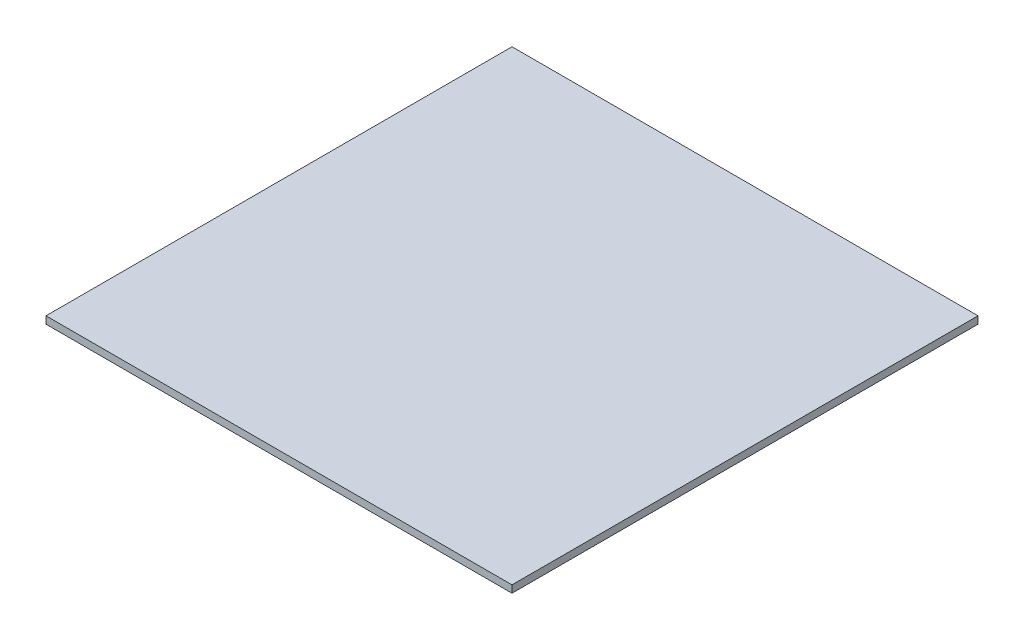
from build123d import *

# Parameters (mm, degrees)
SKETCH1_W           = 304.8
SKETCH1_H           = 304.8
BOSS_EXTRUDE1_DEPTH = 2.38125


with BuildPart() as part:
    # Sketch1 → Boss-Extrude1 (new, symmetric)
    with BuildSketch(Plane(origin=(0, 0, 0), x_dir=(1, 0, 0), z_dir=(0, 1, 0))):
        Rectangle(SKETCH1_W, SKETCH1_H)
    extrude(amount=BOSS_EXTRUDE1_DEPTH, both=True)


solid = part.part
